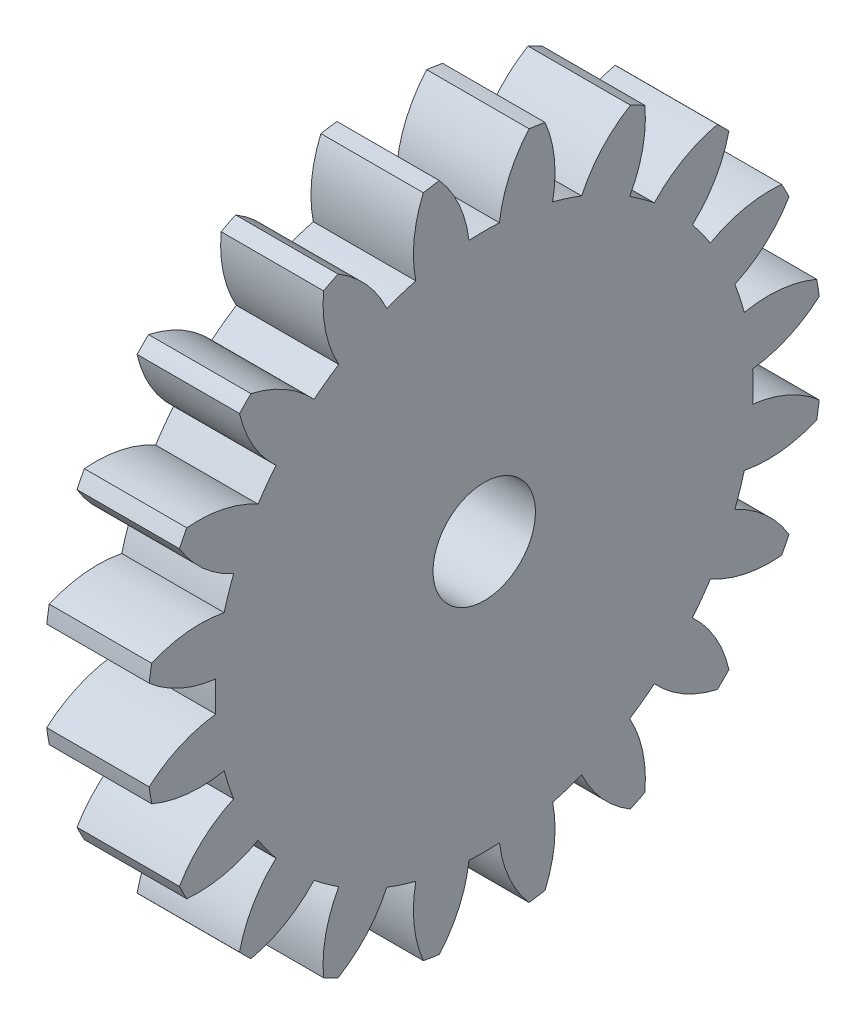
from build123d import *

# Parameters (mm, degrees)
BASPROSKE_W     = 5
BASPROSKE_H     = 16.5
TOOTHCUT_DEPTH  = 24.864199128
TEETHCUTS_COUNT = 20
TEETHCUTS_ANGLE = 342
BORSKE_R        = 2.5
BORE_DEPTH      = 50.0000508


with BuildPart() as part:
    # BasProSke → Base-Revolve (revolve)
    with BuildSketch(Plane(origin=(0, 0, 0), x_dir=(1, 0, 0), z_dir=(0, 1, 0)), mode=Mode.PRIVATE) as base_revolve_sk:
        with Locations((2.5, 8.25)):
            Rectangle(BASPROSKE_W, BASPROSKE_H)
    revolve(base_revolve_sk.sketch.rotate(Axis((-10, 0, 0), (1, 0, 0)), 180), axis=Axis((-10, 0, 0), (1, 0, 0)))

    # TooCutSke → ToothCut (cut, through all)
    with BuildSketch(Plane(origin=(0, 0, 0), x_dir=(0, 0, -1), z_dir=(1, 0, 0))):
        with BuildLine():
            ThreePointArc((0.74381438, 13.102904875), (0, 13.124), (-0.74381438, 13.102904875))
            ThreePointArc((-0.74381438, 13.102904875), (-1.226473103, 14.852072512), (-2.209965745, 16.376962373))
            ThreePointArc((-2.209965745, 16.376962373), (0, 16.5254), (2.209965745, 16.376962373))
            ThreePointArc((2.209965745, 16.376962373), (1.226473103, 14.852072512), (0.74381438, 13.102904875))
        make_face()
    toothcut = extrude(amount=TOOTHCUT_DEPTH, mode=Mode.SUBTRACT)

    # TeethCuts: ToothCut ×20 about axis
    teethcuts_axis = Axis((-10, 0, 0), (1, 0, 0))
    for i in range(1, TEETHCUTS_COUNT):
        add(toothcut.rotate(teethcuts_axis, i * TEETHCUTS_ANGLE / (TEETHCUTS_COUNT - 1)), mode=Mode.SUBTRACT)

    # BorSke → Bore (cut, symmetric)
    with BuildSketch(Plane(origin=(0, 0, 0), x_dir=(0, 0, -1), z_dir=(1, 0, 0))):
        with Locations(Location((0, 0, 0), (0, 0, 180))):
            Circle(BORSKE_R)
    extrude(amount=BORE_DEPTH, both=True, mode=Mode.SUBTRACT)


solid = part.part
